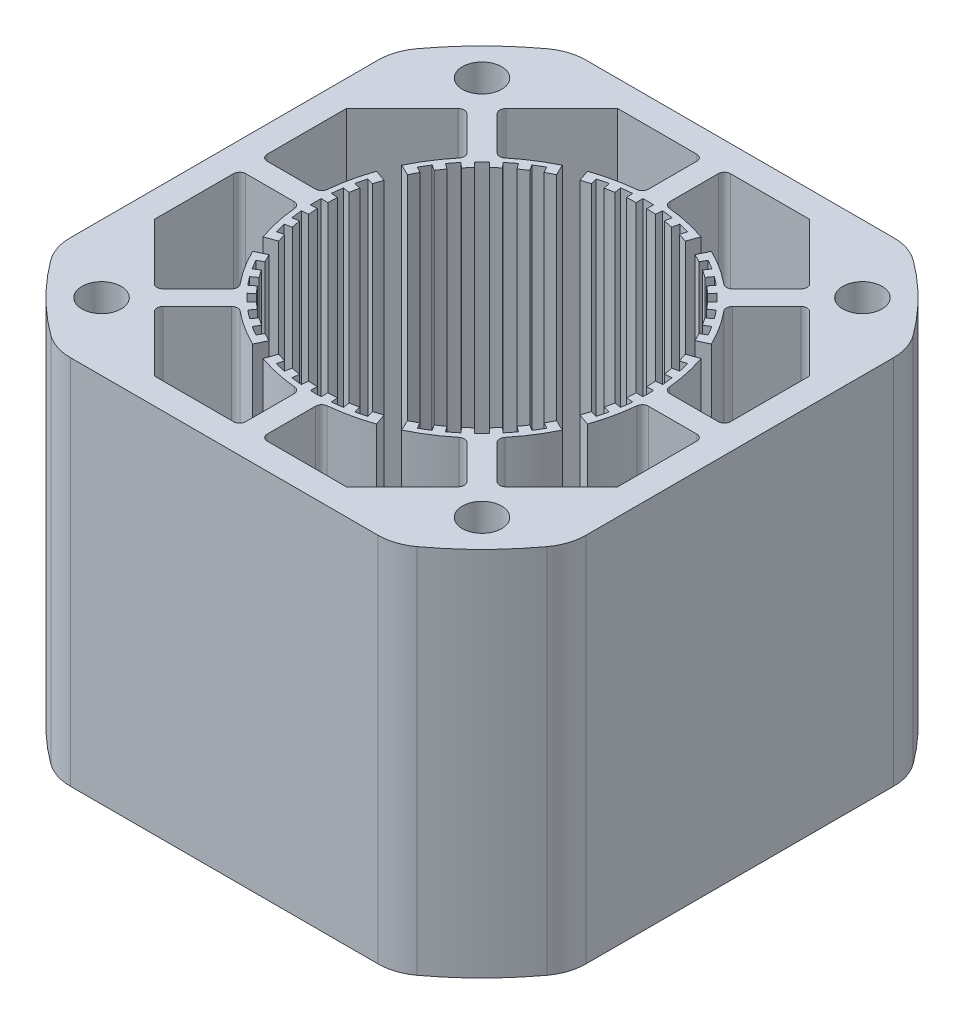
from build123d import *

# Parameters (mm, degrees)
BOSS_EXTRUDE2_DEPTH        = 15.125
BOSS_EXTRUDE3_START        = -15.125
BOSS_EXTRUDE3_DEPTH        = 30.25
CIRPATTERN1_COUNT          = 8
F_3_2_3_2_DIAMETER_HOLE1_D = 3.2


with BuildPart() as part:
    # Sketch10 → Boss-Extrude2 (new, symmetric)
    with BuildSketch(Plane(origin=(0, 0, 0), x_dir=(1, 0, 0), z_dir=(0, 1, 0))):
        with BuildLine():
            Line((12.540559198, 21), (-12.540559198, 21))
            ThreePointArc((-12.540559198, 21), (-13.79041126, 20.799719703), (-14.915102951, 20.218934911))
            ThreePointArc((-14.915102951, 20.218934911), (-17.766057877, 17.766057877), (-20.218934911, 14.915102951))
            ThreePointArc((-20.218934911, 14.915102951), (-20.799719703, 13.79041126), (-21, 12.540559198))
            Line((-21, 12.540559198), (-21, -12.540559198))
            ThreePointArc((-21, -12.540559198), (-20.799719703, -13.79041126), (-20.218934911, -14.915102951))
            ThreePointArc((-20.218934911, -14.915102951), (-17.766057877, -17.766057877), (-14.915102951, -20.218934911))
            ThreePointArc((-14.915102951, -20.218934911), (-13.79041126, -20.799719703), (-12.540559198, -21))
            Line((-12.540559198, -21), (12.540559198, -21))
            ThreePointArc((12.540559198, -21), (13.79041126, -20.799719703), (14.915102951, -20.218934911))
            ThreePointArc((14.915102951, -20.218934911), (17.766057877, -17.766057877), (20.218934911, -14.915102951))
            ThreePointArc((20.218934911, -14.915102951), (20.799719703, -13.79041126), (21, -12.540559198))
            Line((21, -12.540559198), (21, 12.540559198))
            ThreePointArc((21, 12.540559198), (20.799719703, 13.79041126), (20.218934911, 14.915102951))
            ThreePointArc((20.218934911, 14.915102951), (17.766057877, 17.766057877), (14.915102951, 20.218934911))
            ThreePointArc((14.915102951, 20.218934911), (13.79041126, 20.799719703), (12.540559198, 21))
        make_face()
        Polygon((7.81828099, -18.875), (18.875, -7.81828099), (18.875, 7.81828099), (7.81828099, 18.875), (-7.81828099, 18.875), (-18.875, 7.81828099), (-18.875, -7.81828099), (-7.81828099, -18.875), align=None, mode=Mode.SUBTRACT)
    extrude(amount=BOSS_EXTRUDE2_DEPTH, both=True)

    # Sketch11 → Boss-Extrude3 (add)
    with BuildSketch(Plane(origin=(0, 0, 0), x_dir=(1, 0, 0), z_dir=(0, 1, 0)).offset(BOSS_EXTRUDE3_START)):
        with BuildLine():
            Line((-0.875, 18.375), (-0.875, 14.434658811))
            ThreePointArc((-0.875, 14.434658811), (-1.005062913, 14.098286173), (-1.327586207, 13.936911955))
            ThreePointArc((-1.327586207, 13.936911955), (-2.997544584, 13.675332773), (-4.623806337, 13.214401801))
            Line((-4.623806337, 13.214401801), (-4.293534456, 12.270515958))
            ThreePointArc((-4.293534456, 12.270515958), (-3.937790567, 12.389261699), (-3.578769358, 12.497696183))
            Line((-3.578769358, 12.497696183), (-3.730178831, 13.026444868))
            ThreePointArc((-3.730178831, 13.026444868), (-3.302320369, 13.141429914), (-2.870931487, 13.242365815))
            Line((-2.870931487, 13.242365815), (-2.754399213, 12.704852812))
            ThreePointArc((-2.754399213, 12.704852812), (-2.386766867, 12.779019678), (-2.017148078, 12.842550901))
            Line((-2.017148078, 12.842550901), (-2.102488958, 13.385889592))
            ThreePointArc((-2.102488958, 13.385889592), (-1.66374948, 13.447469564), (-1.223231333, 13.494673212))
            Line((-1.223231333, 13.494673212), (-1.173579876, 12.946918949))
            ThreePointArc((-1.173579876, 12.946918949), (-0.799622691, 12.975384524), (-0.425, 12.993051027))
            Line((-0.425, 12.993051027), (-0.442980769, 13.542757032))
            ThreePointArc((-0.442980769, 13.542757032), (0, 13.55), (0.442980769, 13.542757032))
            Line((0.442980769, 13.542757032), (0.425, 12.993051027))
            ThreePointArc((0.425, 12.993051027), (0.799622691, 12.975384524), (1.173579876, 12.946918949))
            Line((1.173579876, 12.946918949), (1.223231333, 13.494673212))
            ThreePointArc((1.223231333, 13.494673212), (1.66374948, 13.447469564), (2.102488958, 13.385889592))
            Line((2.102488958, 13.385889592), (2.017148078, 12.842550901))
            ThreePointArc((2.017148078, 12.842550901), (2.386766867, 12.779019678), (2.754399213, 12.704852812))
            Line((2.754399213, 12.704852812), (2.870931487, 13.242365815))
            ThreePointArc((2.870931487, 13.242365815), (3.302320369, 13.141429914), (3.730178831, 13.026444868))
            Line((3.730178831, 13.026444868), (3.578769358, 12.497696183))
            ThreePointArc((3.578769358, 12.497696183), (3.937790567, 12.389261699), (4.293534456, 12.270515958))
            Line((4.293534456, 12.270515958), (4.623806337, 13.214401801))
            ThreePointArc((4.623806337, 13.214401801), (2.997544584, 13.675332773), (1.327586207, 13.936911955))
            ThreePointArc((1.327586207, 13.936911955), (1.005062913, 14.098286173), (0.875, 14.434658811))
            Line((0.875, 14.434658811), (0.875, 18.375))
            ThreePointArc((0.875, 18.375), (1.021446609, 18.728553391), (1.375, 18.875))
            Line((1.375, 18.875), (-1.375, 18.875))
            ThreePointArc((-1.375, 18.875), (-1.021446609, 18.728553391), (-0.875, 18.375))
        make_face()
    boss_extrude3 = extrude(amount=BOSS_EXTRUDE3_DEPTH)

    # CirPattern1: Boss-Extrude3 ×8 about axis
    cirpattern1_axis = Axis((0, 0, 0), (0, 1, 0))
    for i in range(1, CIRPATTERN1_COUNT):
        add(boss_extrude3.rotate(cirpattern1_axis, i * 360 / CIRPATTERN1_COUNT))

    # Ø3.2 (3.2) Diameter Hole1 (through all)
    with Locations(Plane(origin=(0, 15.125, 0), x_dir=(-1, 0, 0), z_dir=(0, 1, 0))):
        with Locations((-15.5, 15.5), (-15.5, -15.5), (15.5, -15.5), (15.5, 15.5)):
            Hole(F_3_2_3_2_DIAMETER_HOLE1_D / 2)


solid = part.part
